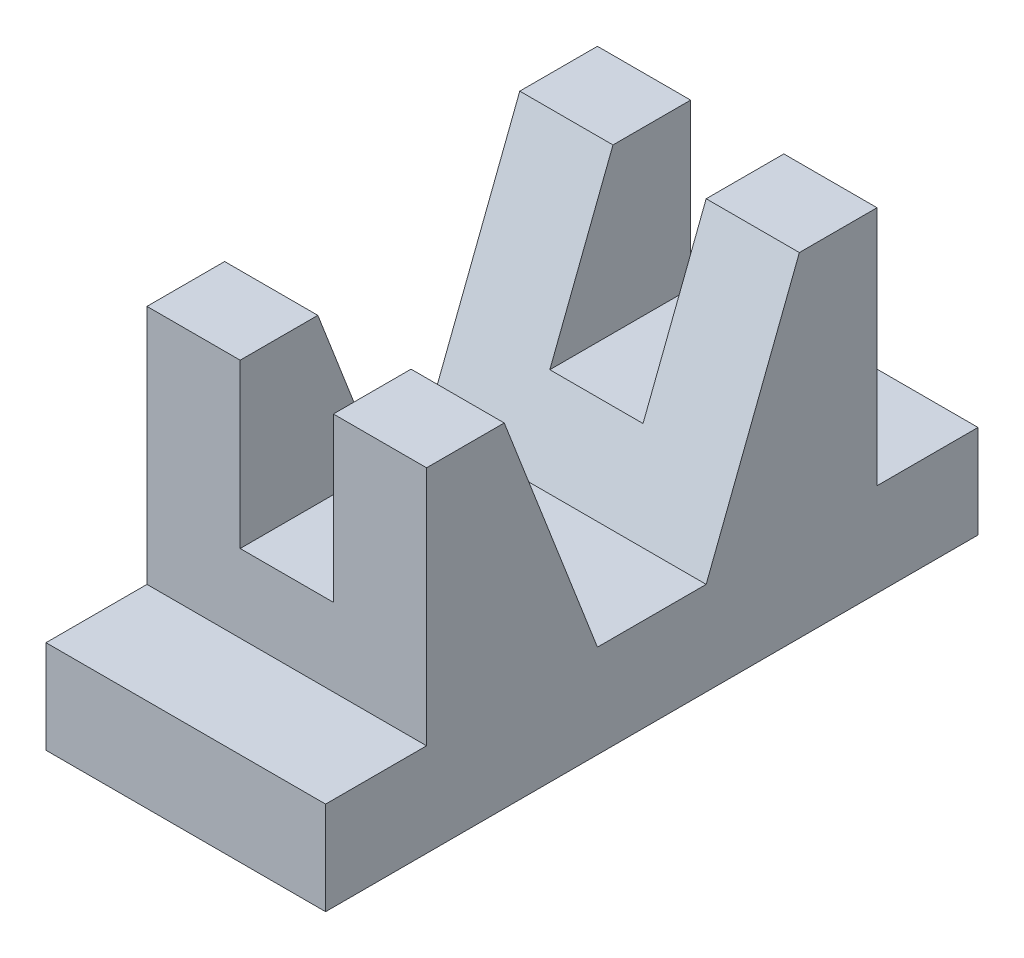
from build123d import *

# Parameters (mm, degrees)
SALIENTE_EXTRUIR1_DEPTH = 36
CROQUIS2_W              = 12
CROQUIS2_H              = 21
CORTAR_EXTRUIR1_DEPTH   = 91.47651629


with BuildPart() as part:
    # Croquis1 → Saliente-Extruir1 (new body)
    with BuildSketch(Plane(origin=(0, 0, 0), x_dir=(0, 0, -1), z_dir=(1, 0, 0))):
        Polygon((42, 0), (-42, 0), (-42, 12), (-29, 12), (-29, 43), (-19, 43), (-7, 12), (7, 12), (19, 43), (29, 43), (29, 12), (42, 12), align=None)
    extrude(amount=SALIENTE_EXTRUIR1_DEPTH)

    # Croquis2 → Cortar-Extruir1 (cut, through all)
    with BuildSketch(Plane.XY.offset(29)):
        with Locations((18, 32.5)):
            Rectangle(CROQUIS2_W, CROQUIS2_H)
    extrude(amount=-CORTAR_EXTRUIR1_DEPTH, mode=Mode.SUBTRACT)


solid = part.part
